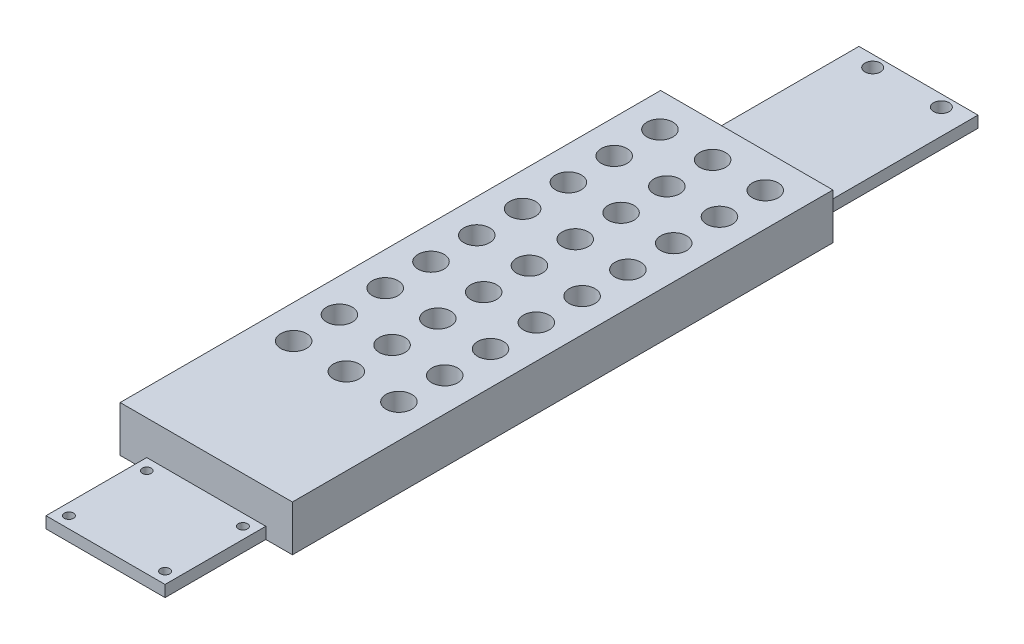
from build123d import *

# Parameters (mm, degrees)
SKETCH1_R           = 2
SKETCH1_R_2         = 3.4
SKETCH1_R_3         = 5.65
BOSS_EXTRUDE1_DEPTH = 20
SKETCH2_W           = 52
SKETCH2_H           = 44
SKETCH2_H_2         = 75
CUT_EXTRUDE1_DEPTH  = 15


with BuildPart() as part:
    # Sketch1 → Boss-Extrude1 (new body)
    with BuildSketch(Plane(origin=(0, 0, 0), x_dir=(1, 0, 0), z_dir=(0, 1, 0))):
        Polygon((26, -118.035), (26, -162.035), (-26, -162.035), (-26, -118.035), (-37.625, -118.035), (-37.625, 118.035), (-26, 118.035), (-26, 193.035), (26, 193.035), (26, 118.035), (37.625, 118.035), (37.625, -118.035), align=None)
        with Locations(Location((-21, -123.035, 0), (0, 0, 270))):
            Circle(SKETCH1_R, mode=Mode.SUBTRACT)
        with Locations(Location((21, -123.035, 0), (0, 0, 270))):
            Circle(SKETCH1_R, mode=Mode.SUBTRACT)
        with Locations(Location((-21, -157.035, 0), (0, 0, 270))):
            Circle(SKETCH1_R, mode=Mode.SUBTRACT)
        with Locations(Location((21, -157.035, 0), (0, 0, 270))):
            Circle(SKETCH1_R, mode=Mode.SUBTRACT)
        with Locations(Location((15, 188.035, 0), (0, 0, 270))):
            Circle(SKETCH1_R_2, mode=Mode.SUBTRACT)
        with Locations(Location((-15, 188.035, 0), (0, 0, 270))):
            Circle(SKETCH1_R_2, mode=Mode.SUBTRACT)
        with Locations(Location((15, 129.035, 0), (0, 0, 270))):
            Circle(SKETCH1_R_2, mode=Mode.SUBTRACT)
        with Locations(Location((-15, 129.035, 0), (0, 0, 270))):
            Circle(SKETCH1_R_2, mode=Mode.SUBTRACT)
        with Locations(Location((-22.995, 103.115, 0), (0, 0, 270))):
            Circle(SKETCH1_R_3, mode=Mode.SUBTRACT)
        with Locations(Location((0.005, 103.115, 0), (0, 0, 270))):
            Circle(SKETCH1_R_3, mode=Mode.SUBTRACT)
        with Locations(Location((23.005, 103.115, 0), (0, 0, 270))):
            Circle(SKETCH1_R_3, mode=Mode.SUBTRACT)
        with Locations(Location((0.005, 83.115, 0), (0, 0, 270))):
            Circle(SKETCH1_R_3, mode=Mode.SUBTRACT)
        with Locations(Location((23.005, 83.115, 0), (0, 0, 270))):
            Circle(SKETCH1_R_3, mode=Mode.SUBTRACT)
        with Locations(Location((0.005, 63.115, 0), (0, 0, 270))):
            Circle(SKETCH1_R_3, mode=Mode.SUBTRACT)
        with Locations(Location((23.005, 63.115, 0), (0, 0, 270))):
            Circle(SKETCH1_R_3, mode=Mode.SUBTRACT)
        with Locations(Location((0.005, 43.115, 0), (0, 0, 270))):
            Circle(SKETCH1_R_3, mode=Mode.SUBTRACT)
        with Locations(Location((23.005, 43.115, 0), (0, 0, 270))):
            Circle(SKETCH1_R_3, mode=Mode.SUBTRACT)
        with Locations(Location((0.005, 23.115, 0), (0, 0, 270))):
            Circle(SKETCH1_R_3, mode=Mode.SUBTRACT)
        with Locations(Location((23.005, 23.115, 0), (0, 0, 270))):
            Circle(SKETCH1_R_3, mode=Mode.SUBTRACT)
        with Locations(Location((0.005, 3.115, 0), (0, 0, 270))):
            Circle(SKETCH1_R_3, mode=Mode.SUBTRACT)
        with Locations(Location((23.005, 3.115, 0), (0, 0, 270))):
            Circle(SKETCH1_R_3, mode=Mode.SUBTRACT)
        with Locations(Location((0.005, -16.885, 0), (0, 0, 270))):
            Circle(SKETCH1_R_3, mode=Mode.SUBTRACT)
        with Locations(Location((23.005, -16.885, 0), (0, 0, 270))):
            Circle(SKETCH1_R_3, mode=Mode.SUBTRACT)
        with Locations(Location((0.005, -36.885, 0), (0, 0, 270))):
            Circle(SKETCH1_R_3, mode=Mode.SUBTRACT)
        with Locations(Location((23.005, -36.885, 0), (0, 0, 270))):
            Circle(SKETCH1_R_3, mode=Mode.SUBTRACT)
        with Locations(Location((0.005, -56.885, 0), (0, 0, 270))):
            Circle(SKETCH1_R_3, mode=Mode.SUBTRACT)
        with Locations(Location((23.005, -56.885, 0), (0, 0, 270))):
            Circle(SKETCH1_R_3, mode=Mode.SUBTRACT)
        with Locations(Location((-22.995, 83.115, 0), (0, 0, 270))):
            Circle(SKETCH1_R_3, mode=Mode.SUBTRACT)
        with Locations(Location((-22.995, 63.115, 0), (0, 0, 270))):
            Circle(SKETCH1_R_3, mode=Mode.SUBTRACT)
        with Locations(Location((-22.995, 43.115, 0), (0, 0, 270))):
            Circle(SKETCH1_R_3, mode=Mode.SUBTRACT)
        with Locations(Location((-22.995, 23.115, 0), (0, 0, 270))):
            Circle(SKETCH1_R_3, mode=Mode.SUBTRACT)
        with Locations(Location((-22.995, 3.115, 0), (0, 0, 270))):
            Circle(SKETCH1_R_3, mode=Mode.SUBTRACT)
        with Locations(Location((-22.995, -16.885, 0), (0, 0, 270))):
            Circle(SKETCH1_R_3, mode=Mode.SUBTRACT)
        with Locations(Location((-22.995, -36.885, 0), (0, 0, 270))):
            Circle(SKETCH1_R_3, mode=Mode.SUBTRACT)
        with Locations(Location((-22.995, -56.885, 0), (0, 0, 270))):
            Circle(SKETCH1_R_3, mode=Mode.SUBTRACT)
    extrude(amount=BOSS_EXTRUDE1_DEPTH)

    # Sketch2 → Cut-Extrude1 (cut)
    with BuildSketch(Plane(origin=(0, 20, 0), x_dir=(1, 0, 0), z_dir=(0, 1, 0))):
        with Locations((0, -140.035)):
            Rectangle(SKETCH2_W, SKETCH2_H)
        with Locations((0, 155.535)):
            Rectangle(SKETCH2_W, SKETCH2_H_2)
    extrude(amount=-CUT_EXTRUDE1_DEPTH, mode=Mode.SUBTRACT)


solid = part.part
